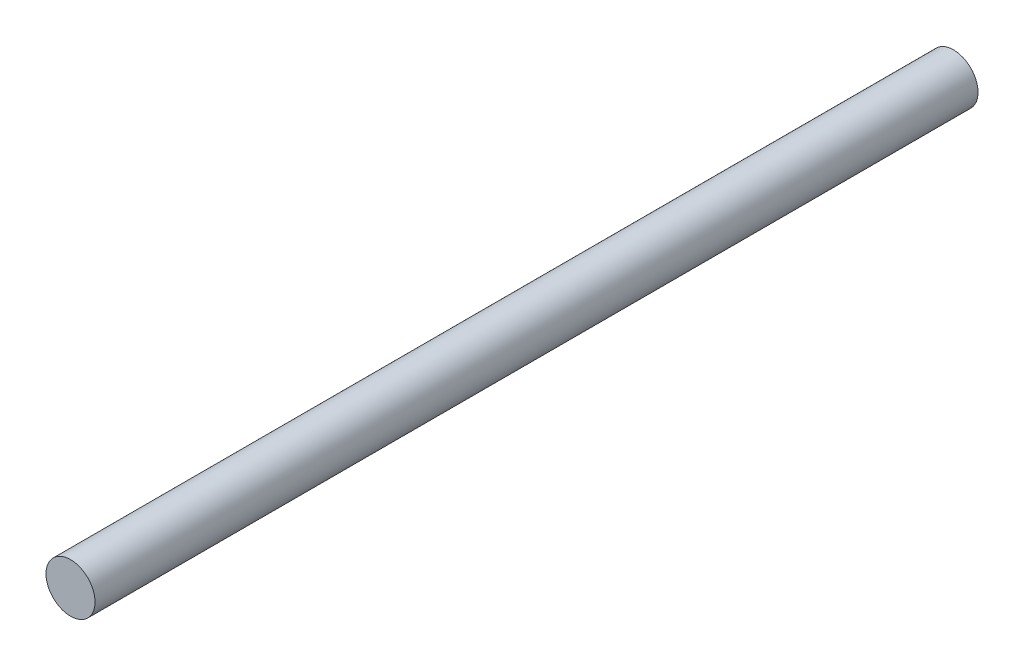
from build123d import *

# Parameters (mm, degrees)
SZKIC1_R                    = 5
DODANIE_WYCI_GNI_CIE1_DEPTH = 180


with BuildPart() as part:
    # Szkic1 → Dodanie-wyciągnięcie1 (new body)
    with BuildSketch(Plane.XY):
        with Locations(Location((0, 0, 0), (0, 0, 180))):
            Circle(SZKIC1_R)
    extrude(amount=DODANIE_WYCI_GNI_CIE1_DEPTH)


solid = part.part
